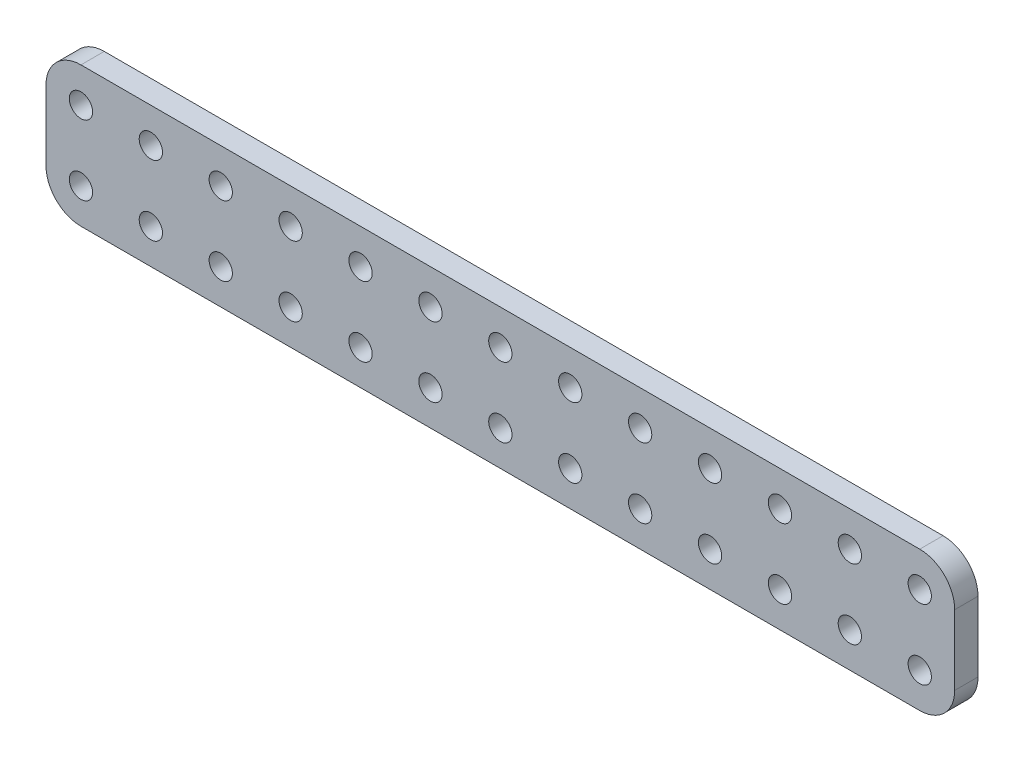
from build123d import *

# Parameters (mm, degrees)
MODEL_R                 = 1.5
SALIENTE_EXTRUIR1_DEPTH = 3


with BuildPart() as part:
    # Model → Saliente-Extruir1 (new body)
    with BuildSketch(Plane.XY):
        with BuildLine():
            Line((256.429131311, 228.742243614), (364.429131311, 228.742243614))
            ThreePointArc((364.429131311, 228.742243614), (367.611111826, 227.424224129), (368.929131311, 224.242243614))
            Line((368.929131311, 224.242243614), (368.929131311, 215.242243614))
            ThreePointArc((368.929131311, 215.242243614), (367.611111826, 212.060263099), (364.429131311, 210.742243614))
            Line((364.429131311, 210.742243614), (256.429131311, 210.742243614))
            ThreePointArc((256.429131311, 210.742243614), (253.247150795, 212.060263099), (251.929131311, 215.242243614))
            Line((251.929131311, 215.242243614), (251.929131311, 224.242243614))
            ThreePointArc((251.929131311, 224.242243614), (253.247150795, 227.424224129), (256.429131311, 228.742243614))
        make_face()
        with Locations((310.429131311, 224.242243614)):
            Circle(MODEL_R, mode=Mode.SUBTRACT)
        with Locations((292.429131311, 224.242243614)):
            Circle(MODEL_R, mode=Mode.SUBTRACT)
        with Locations((301.429131311, 224.242243614)):
            Circle(MODEL_R, mode=Mode.SUBTRACT)
        with Locations((337.429131311, 215.242243614)):
            Circle(MODEL_R, mode=Mode.SUBTRACT)
        with Locations((319.429131311, 215.242243614)):
            Circle(MODEL_R, mode=Mode.SUBTRACT)
        with Locations((328.429131311, 215.242243614)):
            Circle(MODEL_R, mode=Mode.SUBTRACT)
        with Locations((310.429131311, 215.242243614)):
            Circle(MODEL_R, mode=Mode.SUBTRACT)
        with Locations((292.429131311, 215.242243614)):
            Circle(MODEL_R, mode=Mode.SUBTRACT)
        with Locations((301.429131311, 215.242243614)):
            Circle(MODEL_R, mode=Mode.SUBTRACT)
        with Locations((274.429131311, 215.242243614)):
            Circle(MODEL_R, mode=Mode.SUBTRACT)
        with Locations((283.429131311, 215.242243614)):
            Circle(MODEL_R, mode=Mode.SUBTRACT)
        with Locations((265.429131311, 215.242243614)):
            Circle(MODEL_R, mode=Mode.SUBTRACT)
        with Locations((256.429131311, 215.242243614)):
            Circle(MODEL_R, mode=Mode.SUBTRACT)
        with Locations((346.429131311, 215.242243614)):
            Circle(MODEL_R, mode=Mode.SUBTRACT)
        with Locations((274.429131311, 224.242243614)):
            Circle(MODEL_R, mode=Mode.SUBTRACT)
        with Locations((265.429131311, 224.242243614)):
            Circle(MODEL_R, mode=Mode.SUBTRACT)
        with Locations((256.429131311, 224.242243614)):
            Circle(MODEL_R, mode=Mode.SUBTRACT)
        with Locations((283.429131311, 224.242243614)):
            Circle(MODEL_R, mode=Mode.SUBTRACT)
        with Locations((337.429131311, 224.242243614)):
            Circle(MODEL_R, mode=Mode.SUBTRACT)
        with Locations((319.429131311, 224.242243614)):
            Circle(MODEL_R, mode=Mode.SUBTRACT)
        with Locations((328.429131311, 224.242243614)):
            Circle(MODEL_R, mode=Mode.SUBTRACT)
        with Locations((346.429131311, 224.242243614)):
            Circle(MODEL_R, mode=Mode.SUBTRACT)
        with Locations((355.429131311, 215.242243614)):
            Circle(MODEL_R, mode=Mode.SUBTRACT)
        with Locations((355.429131311, 224.242243614)):
            Circle(MODEL_R, mode=Mode.SUBTRACT)
        with Locations((364.429131311, 215.242243614)):
            Circle(MODEL_R, mode=Mode.SUBTRACT)
        with Locations((364.429131311, 224.242243614)):
            Circle(MODEL_R, mode=Mode.SUBTRACT)
    extrude(amount=SALIENTE_EXTRUIR1_DEPTH)


solid = part.part
